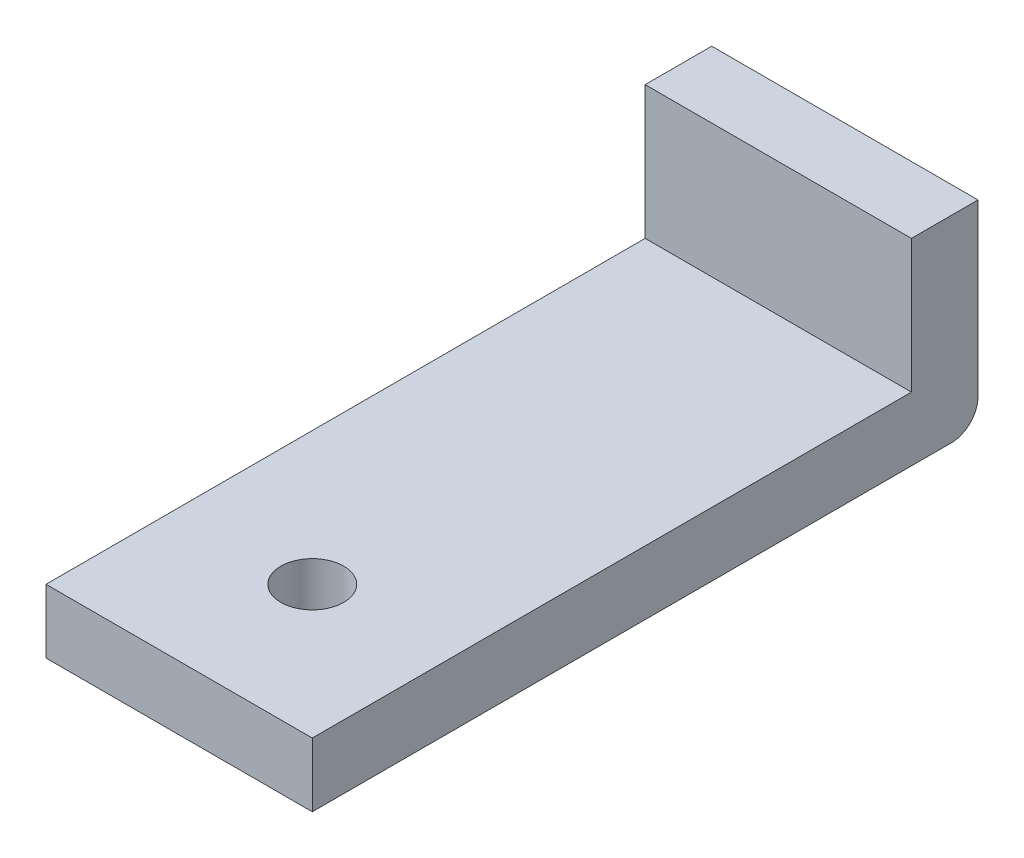
from build123d import *

# Parameters (mm, degrees)
BOSS_EXTRUDE1_DEPTH = 6.35
SKETCH4_R           = 1.5
CUT_EXTRUDE1_DEPTH  = 19.238986403
FILLET1_R           = 1.27


with BuildPart() as part:
    # Sketch1 → Boss-Extrude1 (new, symmetric)
    with BuildSketch(Plane(origin=(0, 0, 0), x_dir=(0, 0, -1), z_dir=(1, 0, 0))):
        Polygon((-15.875, 0), (15.875, 0), (15.875, 9.398), (12.7, 9.398), (12.7, 3.048), (-15.875, 3.048), align=None)
    extrude(amount=BOSS_EXTRUDE1_DEPTH, both=True)

    # Sketch4 → Cut-Extrude1 (cut, through all)
    with BuildSketch(Plane(origin=(0, 3.048, 0), x_dir=(1, 0, 0), z_dir=(0, 1, 0))):
        with Locations(Location((0, -9.525, 0), (0, 0, 270))):
            Circle(SKETCH4_R)
    extrude(amount=-CUT_EXTRUDE1_DEPTH, mode=Mode.SUBTRACT)

    # Fillet1
    fillet1_edges = [part.edges().sort_by_distance(p)[0] for p in [
        (0, 0, -15.875),
    ]]
    fillet(fillet1_edges, radius=FILLET1_R)


solid = part.part
